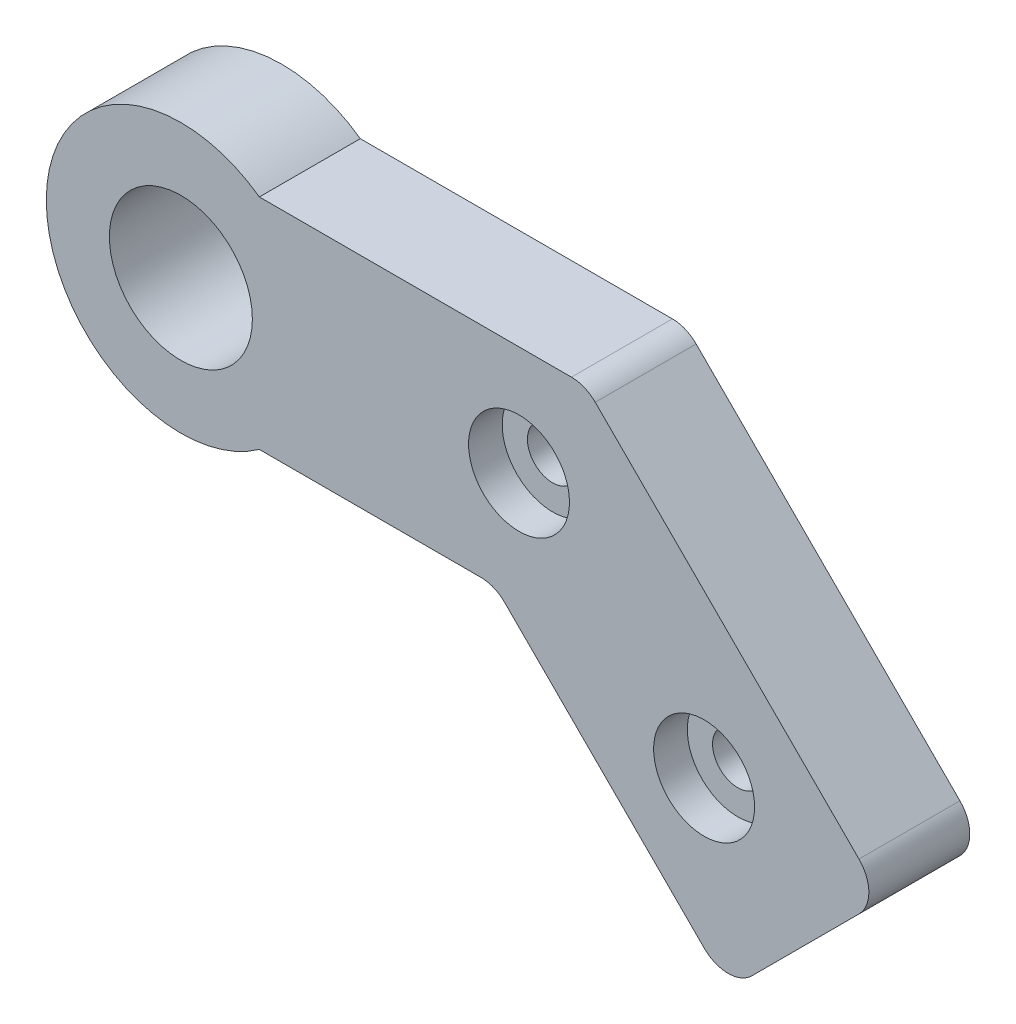
from build123d import *

# Parameters (mm, degrees)
BOSS_EXTRU_1_DEPTH      = 6
CONG_1_R                = 2
ESQUISSE2_R             = 4.25
ESQUISSE2_R_2           = 1.5
ENL_V_MAT_EXTRU_1_DEPTH = 32.582223448
ESQUISSE3_R             = 3
ENL_V_MAT_EXTRU_2_DEPTH = 2


with BuildPart() as part:
    # Esquisse1 → Boss.-Extru.1 (new body)
    with BuildSketch(Plane.XY):
        with BuildLine():
            Line((-12.20197091, 7.520911266), (7.17802909, 7.520911266))
            Line((7.17802909, 7.520911266), (24.855698619, -10.156758263))
            Line((24.855698619, -10.156758263), (15.663310464, -19.349146419))
            Line((15.663310464, -19.349146419), (1.793252779, -5.479088734))
            Line((1.793252779, -5.479088734), (-12.206747221, -5.479088734))
            ThreePointArc((-12.206747221, -5.479088734), (-24.868047126, 1.025564013), (-12.20197091, 7.520911266))
        make_face()
    extrude(amount=BOSS_EXTRU_1_DEPTH)

    # Congé1
    cong_1_edges = [part.edges().sort_by_distance(p)[0] for p in [
        (7.17802909, 7.520911266, 3),
        (24.855698619, -10.156758263, 3),
        (15.663310464, -19.349146419, 3),
        (1.793252779, -5.479088734, 3),
    ]]
    fillet(cong_1_edges, radius=CONG_1_R)

    # Esquisse2 → Enlèv. mat.-Extru.1 (cut, through all)
    with BuildSketch(Plane.XY.offset(6)):
        with Locations((-16.868047666, 1.022624745)):
            Circle(ESQUISSE2_R)
        with Locations((3.231952261, 1.020911266)):
            Circle(ESQUISSE2_R_2)
        with Locations((14.235909876, -9.172857262)):
            Circle(ESQUISSE2_R_2)
    extrude(amount=-ENL_V_MAT_EXTRU_1_DEPTH, mode=Mode.SUBTRACT)

    # Esquisse3 → Enlèv. mat.-Extru.2 (cut)
    with BuildSketch(Plane.XY.offset(6)):
        with Locations((3.231952261, 1.020911266)):
            Circle(ESQUISSE3_R)
        with Locations((14.235909876, -9.172857262)):
            Circle(ESQUISSE3_R)
    extrude(amount=-ENL_V_MAT_EXTRU_2_DEPTH, mode=Mode.SUBTRACT)


solid = part.part
